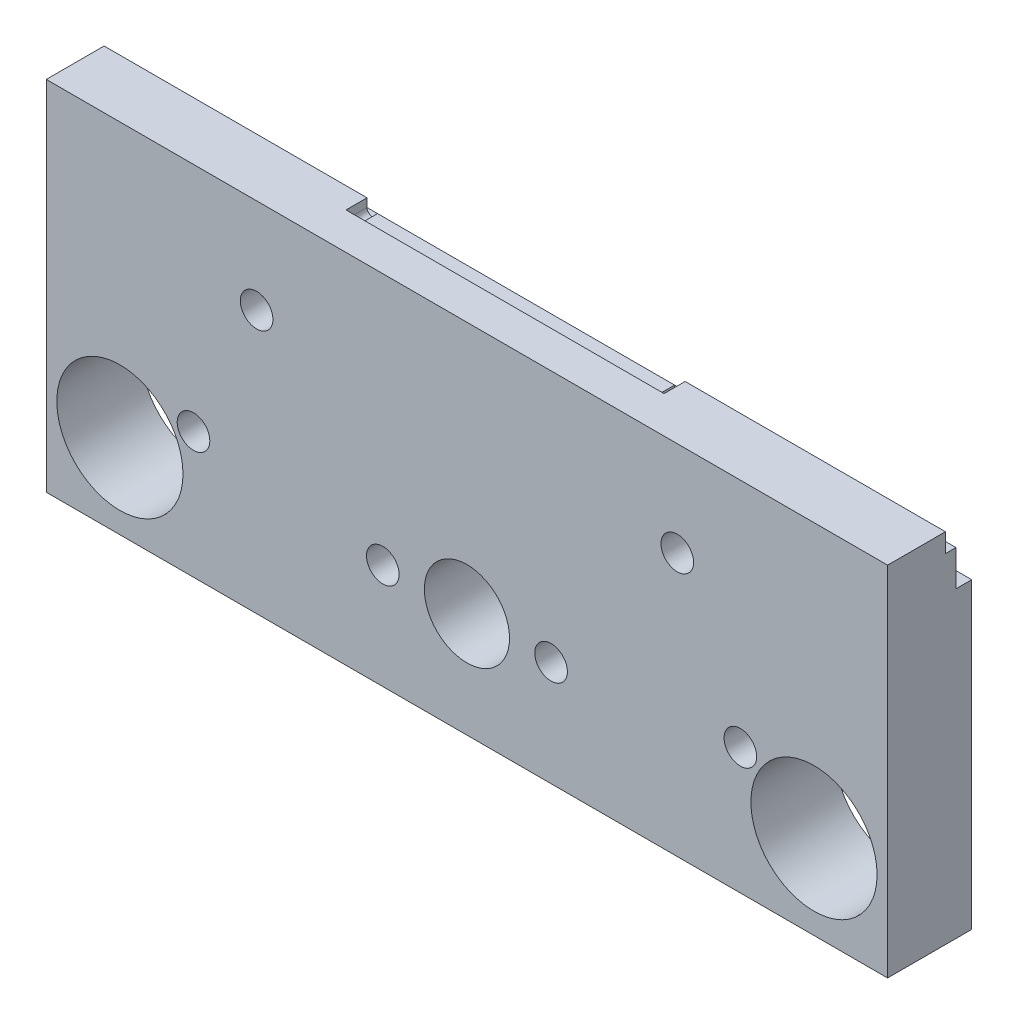
from build123d import *

# Parameters (mm, degrees)
SKETCH_2_W           = 80
SKETCH_2_H           = 34
SKETCH_2_R           = 6
SKETCH_2_R_2         = 4.05
EXTRUDE_1_DEPTH      = 8
CUT_EXTRUDE_2_DEPTH  = 88.292611371
SKETCH_5_R           = 1.55
CUT_EXTRUDE_3_DEPTH  = 88.292611371
CUT_EXTRUDE_5_DEPTH  = 4.5
SKETCH_11_R          = 1.55
CUT_EXTRUDE_7_DEPTH  = 88.292611371
CUT_EXTRUDE_11_DEPTH = 2
SKETCH_22_R          = 1.55
CUT_EXTRUDE_13_DEPTH = 88.292611371


with BuildPart() as part:
    # 草图2 → 凸台-拉伸1 (new body)
    with BuildSketch(Plane.XY):
        with Locations((40, 17)):
            Rectangle(SKETCH_2_W, SKETCH_2_H)
        with Locations((7, 8)):
            Circle(SKETCH_2_R, mode=Mode.SUBTRACT)
        with Locations((40, 10)):
            Circle(SKETCH_2_R_2, mode=Mode.SUBTRACT)
        with Locations((73, 8)):
            Circle(SKETCH_2_R, mode=Mode.SUBTRACT)
    extrude(amount=EXTRUDE_1_DEPTH)

    # 草图4 → 切除-拉伸2 (cut, through all)
    with BuildSketch(Plane(origin=(80, 0, 0), x_dir=(0, 0, -1), z_dir=(1, 0, 0))):
        Polygon((-1.5, 32.2), (-2.5, 32.2), (-2.5, 34), (0, 34), (0, 28.8), (-1.5, 28.8), align=None)
    extrude(amount=-CUT_EXTRUDE_2_DEPTH, mode=Mode.SUBTRACT)

    # 草图5 → 切除-拉伸3 (cut, through all)
    with BuildSketch(Plane.XY.offset(8)):
        with Locations((48, 10)):
            Circle(SKETCH_5_R)
        with Locations((32, 10)):
            Circle(SKETCH_5_R)
    extrude(amount=-CUT_EXTRUDE_3_DEPTH, mode=Mode.SUBTRACT)

    # 草图8 → 切除-拉伸5 (cut)
    with BuildSketch(Plane(origin=(0, 0, 0), x_dir=(-1, 0, 0), z_dir=(0, 0, -1))):
        Polygon((-45.15, 8.354551733), (-45.15, 11.645448267), (-48, 13.290896534), (-50.85, 11.645448267), (-50.85, 8.354551733), (-48, 6.709103466), align=None)
        Polygon((-34.85, 8.354551733), (-32, 6.709103466), (-29.15, 8.354551733), (-29.15, 11.645448267), (-32, 13.290896534), (-34.85, 11.645448267), align=None)
    extrude(amount=-CUT_EXTRUDE_5_DEPTH, mode=Mode.SUBTRACT)

    # 草图11 → 切除-拉伸7 (cut, through all)
    with BuildSketch(Plane(origin=(0, 0, 0), x_dir=(-1, 0, 0), z_dir=(0, 0, -1))):
        with Locations((-60, 25)):
            Circle(SKETCH_11_R)
        with Locations((-20, 25)):
            Circle(SKETCH_11_R)
    extrude(amount=-CUT_EXTRUDE_7_DEPTH, mode=Mode.SUBTRACT)

    # 草图19 → 切除-拉伸11 (cut)
    with BuildSketch(Plane(origin=(0, 0, 2.5), x_dir=(-1, 0, 0), z_dir=(0, 0, -1))):
        with BuildLine():
            Line((-25, 34), (-55.247938178, 34))
            Line((-55.247938178, 34), (-55.247938178, 33.2))
            ThreePointArc((-55.247938178, 33.2), (-54.747938178, 32.7), (-54.247938178, 33.2))
            Line((-54.247938178, 33.2), (-26, 33.2))
            ThreePointArc((-26, 33.2), (-25.5, 32.7), (-25, 33.2))
            Line((-25, 33.2), (-25, 34))
        make_face()
    extrude(amount=-CUT_EXTRUDE_11_DEPTH, mode=Mode.SUBTRACT)

    # 草图22 → 切除-拉伸13 (cut, through all)
    with BuildSketch(Plane(origin=(0, 0, 0), x_dir=(-1, 0, 0), z_dir=(0, 0, -1))):
        with Locations((-66, 12)):
            Circle(SKETCH_22_R)
        with Locations(Location((-14, 12, 0), (0, 0, 180))):
            Circle(SKETCH_22_R)
    extrude(amount=-CUT_EXTRUDE_13_DEPTH, mode=Mode.SUBTRACT)


solid = part.part
